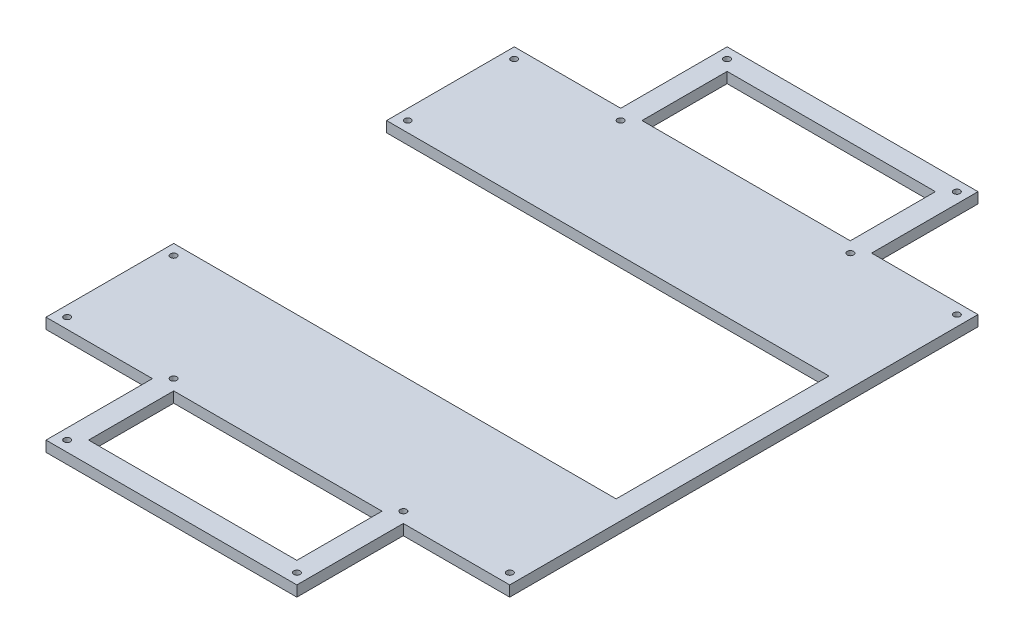
from build123d import *

# Parameters (mm, degrees)
ESQUISSE1_R        = 1.5
ESQUISSE1_W        = 97.855109658
ESQUISSE1_H        = 40
BOSS_EXTRU_1_DEPTH = 5


with BuildPart() as part:
    # Esquisse1 → Boss.-Extru.1 (new body)
    with BuildSketch(Plane(origin=(0, 0, 0), x_dir=(1, 0, 0), z_dir=(0, 1, 0))):
        Polygon((-58.927554829, 110), (-58.927554829, 160), (58.927554829, 160), (58.927554829, 110), (108.927554829, 110), (108.927554829, -110), (58.927554829, -110), (58.927554829, -160), (-58.927554829, -160), (-58.927554829, -110), (-108.927554829, -110), (-108.927554829, -50), (98.927554829, -50), (98.927554829, 50), (-108.927554829, 50), (-108.927554829, 110), align=None)
        with Locations(Location((-103.976302336, -105, 0), (0, 0, 270))):
            Circle(ESQUISSE1_R, mode=Mode.SUBTRACT)
        with Locations(Location((-103.976302336, -55, 0), (0, 0, 270))):
            Circle(ESQUISSE1_R, mode=Mode.SUBTRACT)
        with Locations(Location((-53.976302336, -105, 0), (0, 0, 270))):
            Circle(ESQUISSE1_R, mode=Mode.SUBTRACT)
        with Locations(Location((-53.976302336, -155, 0), (0, 0, 270))):
            Circle(ESQUISSE1_R, mode=Mode.SUBTRACT)
        with Locations(Location((-53.976302336, 155, 0), (0, 0, 90))):
            Circle(ESQUISSE1_R, mode=Mode.SUBTRACT)
        with Locations(Location((-53.976302336, 105, 0), (0, 0, 90))):
            Circle(ESQUISSE1_R, mode=Mode.SUBTRACT)
        with Locations(Location((-103.976302336, 105, 0), (0, 0, 90))):
            Circle(ESQUISSE1_R, mode=Mode.SUBTRACT)
        with Locations(Location((-103.976302336, 55, 0), (0, 0, 90))):
            Circle(ESQUISSE1_R, mode=Mode.SUBTRACT)
        with Locations(Location((53.976302336, -155, 0), (0, 0, 90))):
            Circle(ESQUISSE1_R, mode=Mode.SUBTRACT)
        with Locations(Location((53.976302336, -105, 0), (0, 0, 90))):
            Circle(ESQUISSE1_R, mode=Mode.SUBTRACT)
        with Locations(Location((103.976302336, -105, 0), (0, 0, 90))):
            Circle(ESQUISSE1_R, mode=Mode.SUBTRACT)
        with Locations(Location((103.976302336, 105, 0), (0, 0, 270))):
            Circle(ESQUISSE1_R, mode=Mode.SUBTRACT)
        with Locations(Location((53.976302336, 105, 0), (0, 0, 270))):
            Circle(ESQUISSE1_R, mode=Mode.SUBTRACT)
        with Locations(Location((53.976302336, 155, 0), (0, 0, 270))):
            Circle(ESQUISSE1_R, mode=Mode.SUBTRACT)
        with Locations((0, -130)):
            Rectangle(ESQUISSE1_W, ESQUISSE1_H, mode=Mode.SUBTRACT)
        with Locations((0, 130)):
            Rectangle(ESQUISSE1_W, ESQUISSE1_H, mode=Mode.SUBTRACT)
    extrude(amount=BOSS_EXTRU_1_DEPTH)


solid = part.part
